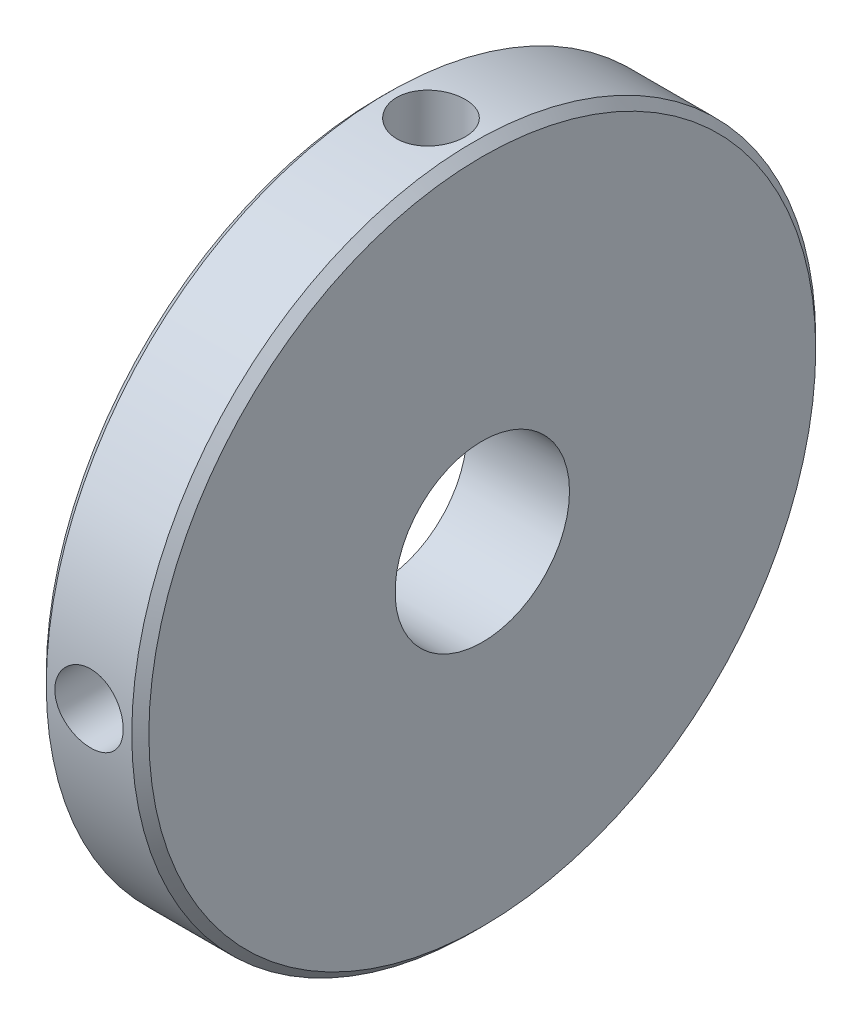
from build123d import *

# Parameters (mm, degrees)
ESQUISSE1_W                  = 6
ESQUISSE1_H                  = 20
CHANFREIN1_SIZE              = 0.5
R_P_TITION_CIRCULAIRE1_COUNT = 4
TROU_TARAUD_M12X1_752_D      = 10.2


with BuildPart() as part:
    # Esquisse1 → Base-Révolution (revolve)
    with BuildSketch(Plane.XY, mode=Mode.PRIVATE) as base_r_volution_sk:
        with Locations((3, 10)):
            Rectangle(ESQUISSE1_W, ESQUISSE1_H)
    revolve(base_r_volution_sk.sketch.rotate(Axis((-6.22145749, 0, 0), (1, 0, 0)), 90), axis=Axis((-6.22145749, 0, 0), (1, 0, 0)))

    # Chanfrein1
    chanfrein1_edges = [part.edges().sort_by_distance(p)[0] for p in [
        (6, 0, -20),
        (0, 0, -20),
    ]]
    chamfer(chanfrein1_edges, length=CHANFREIN1_SIZE)

    # Esquisse2 → Trou radial (revolve, cut)
    with BuildSketch(Plane.XY, mode=Mode.PRIVATE) as trou_radial_sk:
        Polygon((5, 20), (3, 20), (3, 13.798278762), (5, 15), align=None)
    trou_radial = revolve(trou_radial_sk.sketch.rotate(Axis((3, 20, 0), (0, -1, 0)), 180), axis=Axis((3, 20, 0), (0, -1, 0)), mode=Mode.SUBTRACT)

    # Répétition circulaire1: Trou radial ×4 about axis
    r_p_tition_circulaire1_axis = Axis((43.77854251, 0, 0), (-1, 0, 0))
    for i in range(1, R_P_TITION_CIRCULAIRE1_COUNT):
        add(trou_radial.rotate(r_p_tition_circulaire1_axis, i * 360 / R_P_TITION_CIRCULAIRE1_COUNT), mode=Mode.SUBTRACT)

    # Trou taraudé M12x1.752 (through all)
    with Locations(Plane(origin=(6, 0, 0), x_dir=(0, 0, -1), z_dir=(1, 0, 0))):
        with Locations((0, 0)):
            Hole(TROU_TARAUD_M12X1_752_D / 2)


solid = part.part
